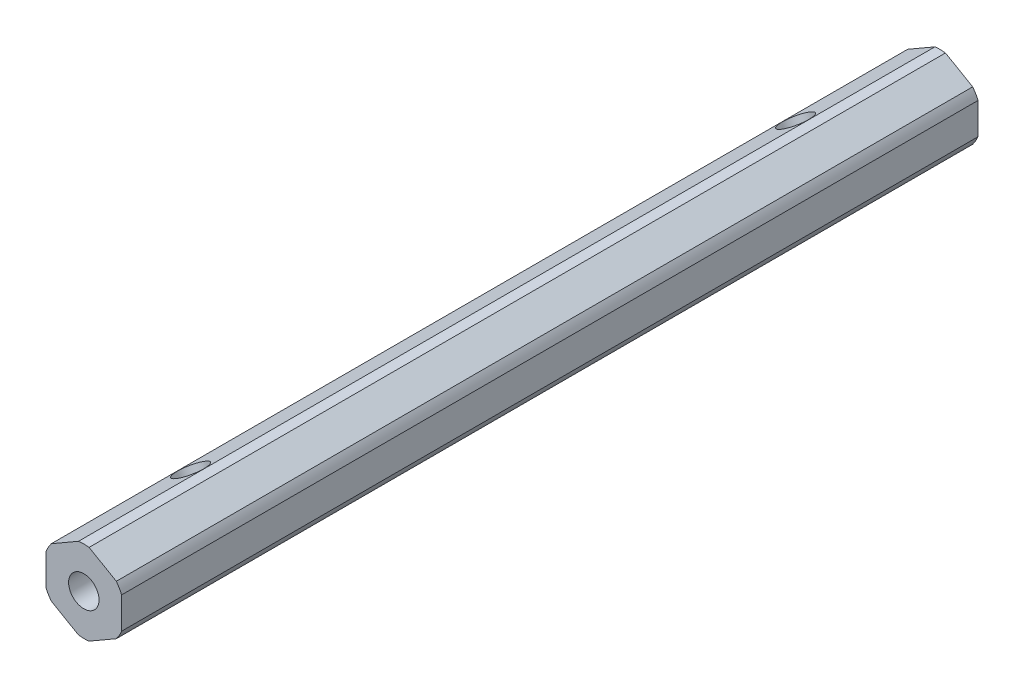
from build123d import *

# Parameters (mm, degrees)
SHAFT_BOSS_DEPTH                = 457.2
SKETCH2_R                       = 9.41705
SKETCH2_R_2                     = 6.87705
CUT_FOR_THUNDER_HEX_ROUND_DEPTH = 914.4
SKETCH3_R                       = 2.5527
CENTER_HOLE_CUT_DEPTH           = 914.4
F_10_CLEARANCE_HOLE1_D          = 5.1054


with BuildPart() as part:
    # Sketch1 → Shaft Boss (new, symmetric)
    with BuildSketch(Plane.XY):
        Polygon((0, 7.332348419), (-6.35, 3.666174209), (-6.35, -3.666174209), (0, -7.332348419), (6.35, -3.666174209), (6.35, 3.666174209), align=None)
    extrude(amount=SHAFT_BOSS_DEPTH, both=True)

    # Sketch2 → Cut For Thunder Hex Round (cut)
    with BuildSketch(Plane(origin=(0, 0, -457.2), x_dir=(-1, 0, 0), z_dir=(0, 0, -1))):
        Circle(SKETCH2_R)
        Circle(SKETCH2_R_2, mode=Mode.SUBTRACT)
    extrude(amount=-CUT_FOR_THUNDER_HEX_ROUND_DEPTH, mode=Mode.SUBTRACT)

    # Sketch3 → Center Hole Cut (cut)
    with BuildSketch(Plane(origin=(0, 0, -457.2), x_dir=(-1, 0, 0), z_dir=(0, 0, -1))):
        Circle(SKETCH3_R)
    extrude(amount=-CENTER_HOLE_CUT_DEPTH, mode=Mode.SUBTRACT)

    # SurfaceCut1
    split(bisect_by=Plane(origin=(0, 0, 71.9105), x_dir=(-1, 0, 0), z_dir=(0, 0, -1)), keep=Keep.TOP)

    # SurfaceCut2
    split(bisect_by=Plane.XY.offset(-71.9105), keep=Keep.TOP)

    # #10 Clearance Hole1 (through all)
    with Locations(Plane(origin=(3.175, -5.499261314, 0), x_dir=(-0.8660254037844388, -0.49999999999999983, 0), z_dir=(0.4999999999999998, -0.8660254037844387, 0))):
        with Locations((0, 50.8), (0, -50.8)):
            Hole(F_10_CLEARANCE_HOLE1_D / 2)


solid = part.part
